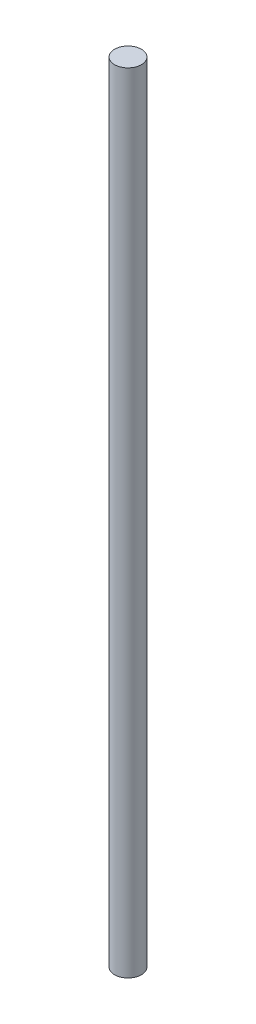
from build123d import *

# Parameters (mm, degrees)
SKETCH_1_R      = 8.5
EXTRUDE_1_DEPTH = 500


with BuildPart() as part:
    # 草图1 → 凸台-拉伸1 (new body)
    with BuildSketch(Plane(origin=(0, 0, 0), x_dir=(1, 0, 0), z_dir=(0, 1, 0))):
        with Locations(Location((0, 0, 0), (0, 0, 270))):
            Circle(SKETCH_1_R)
    extrude(amount=EXTRUDE_1_DEPTH)


solid = part.part
